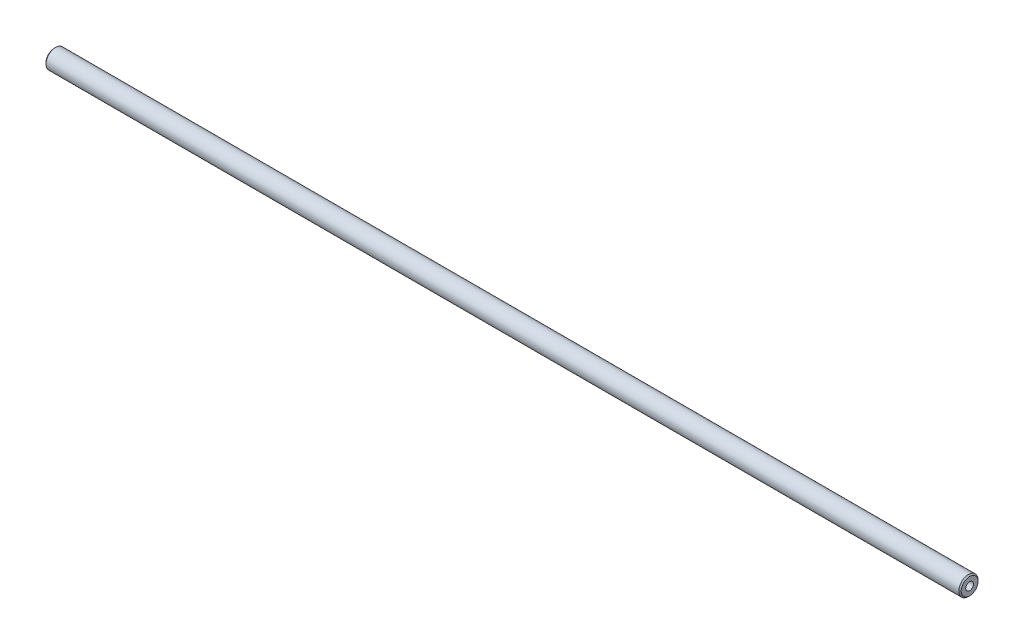
from build123d import *


with BuildPart() as part:
    # Sketch1 → Revolve1 (revolve)
    with BuildSketch(Plane.XY, mode=Mode.PRIVATE) as revolve1_sk:
        Polygon((-175.8, 1.621), (-174.826004937, 0), (174.826004937, 0), (175.8, 1.621), (190.8, 1.621), (190.8, 3.5), (190.3, 4), (-190.3, 4), (-190.8, 3.5), (-190.8, 1.621), align=None)
    revolve(revolve1_sk.sketch.rotate(Axis((-190.96, 0, 0), (1, 0, 0)), 270), axis=Axis((-190.96, 0, 0), (1, 0, 0)))


solid = part.part
